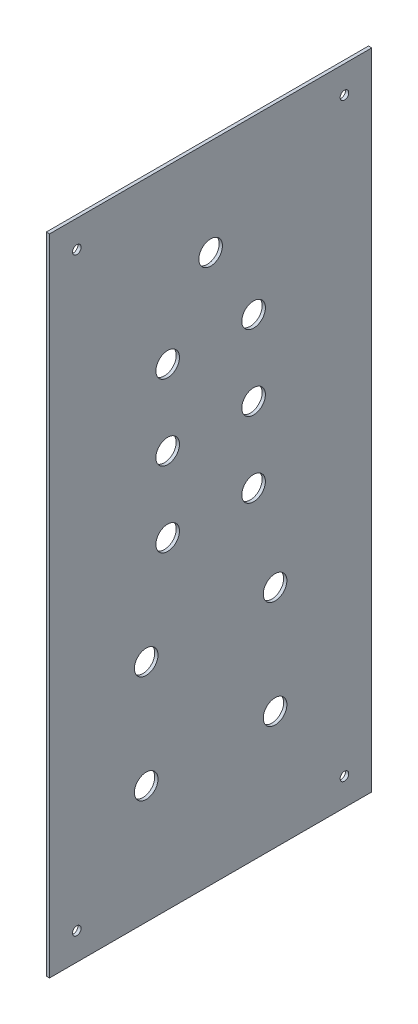
from build123d import *

# Parameters (mm, degrees)
SKETCH2_W                            = 300
SKETCH2_H                            = 150
BOSS_EXTRUDE1_DEPTH                  = 1.52
F_4_0_4_DIAMETER_HOLE1_D             = 4
MIRROR1_AT_THE_SECOND_PLANE_COPY_1_D = 4
F_11_0_11_DIAMETER_HOLE4_D           = 11
F_11_0_11_DIAMETER_HOLE2_D           = 11
F_11_0_11_DIAMETER_HOLE3_D           = 11


with BuildPart() as part:
    # Sketch2 → Boss-Extrude1 (new body)
    with BuildSketch(Plane.YZ):
        Rectangle(SKETCH2_W, SKETCH2_H)
    extrude(amount=BOSS_EXTRUDE1_DEPTH)

    # Ø4.0 (4) Diameter Hole1 (through all)
    with Locations(Plane.YZ.offset(1.52)):
        with Locations((-137.3, 62.3)):
            f_4_0_4_diameter_hole1 = Hole(F_4_0_4_DIAMETER_HOLE1_D / 2)

    # Mirror1: Ø4.0 (4) Diameter Hole1 across plane
    add(f_4_0_4_diameter_hole1.mirror(Plane.ZX), mode=Mode.SUBTRACT)

    # Mirror1 at the second plane: Ø4.0 (4) Diameter Hole1 across plane
    add(f_4_0_4_diameter_hole1.mirror(Plane.XY), mode=Mode.SUBTRACT)

    # Mirror1 at the second plane copy 1 (through all)
    with Locations(Plane(origin=(1.52, 0, 0), x_dir=(0, -1, 0), z_dir=(1, 0, 0))):
        with Locations((-137.3, 62.3)):
            Hole(MIRROR1_AT_THE_SECOND_PLANE_COPY_1_D / 2)

    # Ø11.0 (11) Diameter Hole4 (through all)
    with Locations(Plane.YZ.offset(1.52)):
        with Locations((-95, 30), (-45, 30)):
            f_11_0_11_diameter_hole4 = Hole(F_11_0_11_DIAMETER_HOLE4_D / 2)

    # Mirror2: Ø11.0 (11) Diameter Hole4 across plane
    add(f_11_0_11_diameter_hole4.mirror(Plane.XY), mode=Mode.SUBTRACT)

    # Ø11.0 (11) Diameter Hole2 (through all)
    with Locations(Plane.YZ.offset(1.52)):
        with Locations((0, 20), (35, 20), (70, 20)):
            f_11_0_11_diameter_hole2 = Hole(F_11_0_11_DIAMETER_HOLE2_D / 2)

    # Mirror3: Ø11.0 (11) Diameter Hole2 across plane
    add(f_11_0_11_diameter_hole2.mirror(Plane.XY), mode=Mode.SUBTRACT)

    # Ø11.0 (11) Diameter Hole3 (through all)
    with Locations(Plane.YZ.offset(1.52)):
        with Locations((105, 0)):
            Hole(F_11_0_11_DIAMETER_HOLE3_D / 2)


solid = part.part
